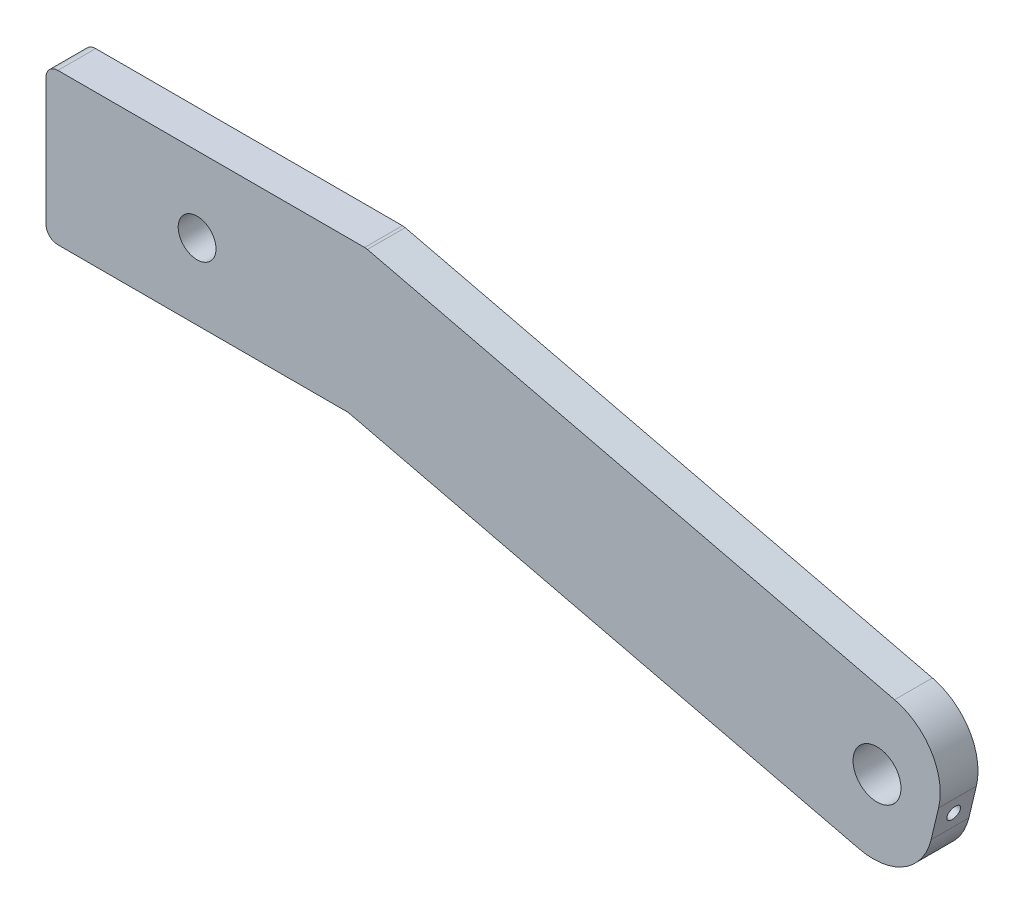
from build123d import *

# Parameters (mm, degrees)
SKETCH1_R               = 3.175
SKETCH1_R_2             = 4.025
BOSS_EXTRUDE1_DEPTH     = 6.35
CUT_EXTRUDE2_REACH      = 155.866
CUT_EXTRUDE2_END_RADIUS = 4.025
SKETCH3_R               = 1.1303
FILLET4_R               = 10
SKETCH4_W               = 6.35
SKETCH4_H               = 6.35
SKETCH4_W_2             = 25.4
BOSS_EXTRUDE2_DEPTH     = 4.7625
FILLET3_R               = 2


with BuildPart() as part:
    # Sketch1 → Boss-Extrude1 (new body)
    with BuildSketch(Plane.XY):
        Polygon((-38.1, -12.7), (-38.1, 12.7), (15.701735639, 12.7), (114.28491418, -10.930870684), (108.364133554, -35.631161305), (12.7, -12.7), align=None)
        with Locations((-12.7, 0)):
            Circle(SKETCH1_R, mode=Mode.SUBTRACT)
        with Locations((101.6, -20.95)):
            Circle(SKETCH1_R_2, mode=Mode.SUBTRACT)
    extrude(amount=BOSS_EXTRUDE1_DEPTH)

    # Cut-Extrude2: up to this cylinder (the profile starts outside it)
    cut_extrude2_end = Plane(origin=(101.6, -20.95, 3.175), z_dir=(0, 0, -1)) * Cylinder(CUT_EXTRUDE2_END_RADIUS, 320.782, mode=Mode.PRIVATE)
    # Sketch3 → Cut-Extrude2 (cut, up to the surface)
    with BuildSketch(Plane(origin=(110.552900462, -26.500071647, 0), x_dir=(0, 0, -1), z_dir=(0.9724523866696595, -0.23310159943784806, 0)), mode=Mode.PRIVATE) as cut_extrude2_sk1:
        with Locations(Location((-3.175, 3.310245002, 0), (0, 0, 90))):
            Circle(SKETCH3_R)
    cut_extrude2_tool1 = extrude(cut_extrude2_sk1.sketch, amount=-CUT_EXTRUDE2_REACH, mode=Mode.PRIVATE) - cut_extrude2_end
    add(cut_extrude2_tool1.solids().sort_by_distance((111.324524, -23.281016, 3.175))[0], mode=Mode.SUBTRACT)

    # Fillet4
    fillet4_edges = [part.edges().sort_by_distance(p)[0] for p in [
        (108.364133554, -35.631161305, 3.175),
        (114.28491418, -10.930870684, 3.175),
    ]]
    fillet(fillet4_edges, radius=FILLET4_R)

    # Sketch4 → Boss-Extrude2 (add)
    with BuildSketch(Plane.XY):
        with Locations((-28.575, 0)):
            Rectangle(SKETCH4_W, SKETCH4_H)
        with Locations((7.9375, 0)):
            Rectangle(SKETCH4_W_2, SKETCH4_H)
    extrude(amount=-BOSS_EXTRUDE2_DEPTH)

    # Fillet3
    fillet3_edges = [part.edges().sort_by_distance(p)[0] for p in [
        (12.7, -12.7, 3.175),
        (-38.1, -12.7, 3.175),
        (-38.1, 12.7, 3.175),
        (15.701735639, 12.7, 3.175),
        (-25.4, -3.175, -2.38125),
        (-31.75, -3.175, -2.38125),
        (-31.75, 3.175, -2.38125),
        (-25.4, 3.175, -2.38125),
        (20.6375, -3.175, -2.38125),
        (-4.7625, -3.175, -2.38125),
        (-4.7625, 3.175, -2.38125),
        (20.6375, 3.175, -2.38125),
    ]]
    fillet(fillet3_edges, radius=FILLET3_R)


solid = part.part
